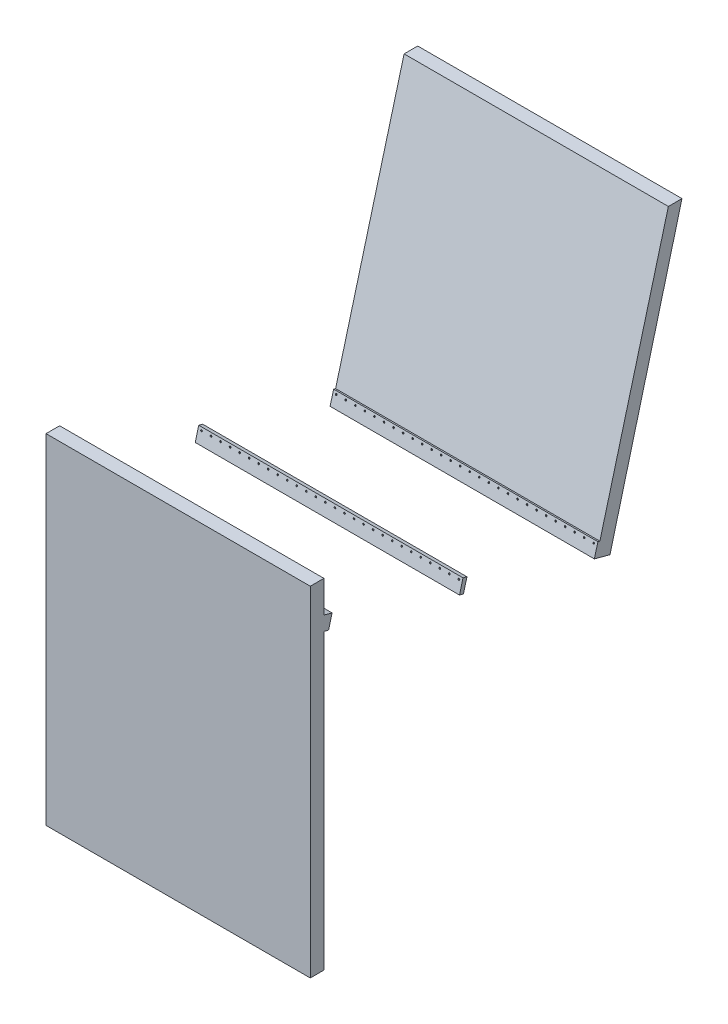
from build123d import *

# Parameters (mm, degrees)
SKETCH1_W                = 1940
SKETCH1_H                = 100
BOSS_EXTRUDE1_DEPTH      = 2000
BOSS_EXTRUDE1_2_DEPTH    = 2000
CUT_EXTRUDE1_DEPTH       = 2481.100804403
CUT_EXTRUDE1_DEPTH_BACK  = 2481.100804403
BOSS_EXTRUDE3_DEPTH      = 970
BOSS_EXTRUDE3_DEPTH_BACK = 970
SKETCH1_3_W              = 1940
SKETCH1_3_H              = 100
BOSS_EXTRUDE4_DEPTH      = 2100
CUT_EXTRUDE2_REACH       = 3721.358
SKETCH1_5_W              = 1940
SKETCH1_5_H              = 100
CUT_EXTRUDE3_REACH       = 2473.755
SKETCH7_W                = 1940
SKETCH7_H                = 995
CUT_EXTRUDE4_DEPTH       = 15
CUT_EXTRUDE5_DEPTH       = 30
CUT_EXTRUDE6_DEPTH       = 15
SKETCH1_6_W              = 1940
SKETCH1_6_H              = 100
BOSS_EXTRUDE5_DEPTH      = 390.899793


with BuildPart() as part:
    # Sketch1 → Boss-Extrude1 (new body)
    with BuildSketch(Plane(origin=(0, 0, 0), x_dir=(1, 0, 0), z_dir=(0, 1, 0))):
        with Locations((0, -1050)):
            Rectangle(SKETCH1_W, SKETCH1_H)
    extrude(amount=BOSS_EXTRUDE1_DEPTH)


with BuildPart() as body_2:
    # Sketch1 → Boss-Extrude1 2 (new body)
    with BuildSketch(Plane(origin=(0, 0, 0), x_dir=(1, 0, 0), z_dir=(0, 1, 0))):
        with Locations((0, 1050)):
            Rectangle(SKETCH1_W, SKETCH1_H)
    extrude(amount=BOSS_EXTRUDE1_2_DEPTH)


with BuildPart() as cut_extrude1_tool:
    # Sketch2 → Cut-Extrude1 (new, two sides: drawn at the far end of the back side and taken through both)
    with BuildSketch(Plane(origin=(0, 0, 0), x_dir=(0, 0, -1), z_dir=(1, 0, 0)).offset(-CUT_EXTRUDE1_DEPTH_BACK)):
        Polygon((1100, 1200), (-1100, 1789.488223348), (-1100, 2789.488223348), (1100, 2789.488223348), align=None)
    extrude(amount=CUT_EXTRUDE1_DEPTH + CUT_EXTRUDE1_DEPTH_BACK)


with BuildPart() as part_1:
    add(part.part)

    # Cut-Extrude1: cut by cut_extrude1_tool
    add(cut_extrude1_tool.part, mode=Mode.SUBTRACT)



with BuildPart() as body_2_1:
    add(body_2.part)

    # Cut-Extrude1: cut by cut_extrude1_tool
    add(cut_extrude1_tool.part, mode=Mode.SUBTRACT)

    # Sketch6 → section 1 of loft2
    with BuildSketch(Plane(origin=(0, 3200, 0), x_dir=(1, 0, 0), z_dir=(0, 1, 0)), mode=Mode.PRIVATE) as loft2_s1:
        with BuildLine():
            Line((-970, 1528.71870789), (970, 1528.71870789))
            Line((970, 1528.71870789), (970, 1628.71870789))
            Line((970, 1628.71870789), (-970, 1628.71870789))
            Line((-970, 1628.71870789), (-970, 1528.71870789))
        make_face()
    # loft from a face of the part (loft2)
    loft([body_2_1.faces().sort_by_distance((0, 1213.397459622, -1050))[0], loft2_s1.sketch])


with BuildPart() as part_2:
    add(part_1.part)

    add(body_2_1.part)  # Boss-Extrude3 merges body 2
    # Sketch4 → Boss-Extrude3 (add, two sides: drawn at the far end of the back side and taken through both)
    with BuildSketch(Plane(origin=(0, 0, 0), x_dir=(0, 0, -1), z_dir=(1, 0, 0)).offset(-BOSS_EXTRUDE3_DEPTH_BACK)):
        Polygon((1100, 1200), (-1100, 1789.488223348), (-1100, 1893.015841389), (1125.558090094, 1296.67934844), align=None)
    extrude(amount=BOSS_EXTRUDE3_DEPTH + BOSS_EXTRUDE3_DEPTH_BACK)

    # Sketch1<3> → Boss-Extrude4 (add)
    with BuildSketch(Plane(origin=(0, 0, 0), x_dir=(1, 0, 0), z_dir=(0, 1, 0))):
        with Locations((0, -1050)):
            Rectangle(SKETCH1_3_W, SKETCH1_3_H)
    extrude(amount=BOSS_EXTRUDE4_DEPTH)

    # Cut-Extrude2: up to this face of the body (flat: up to its plane)
    cut_extrude2_end = Plane(part_2.part.faces().sort_by_distance((0, 1494.744111674, 0))[0])
    # Sketch1<5> → Cut-Extrude2 (cut, up to the picked face)
    with BuildSketch(Plane(origin=(0, 0, 0), x_dir=(1, 0, 0), z_dir=(0, 1, 0)), mode=Mode.PRIVATE) as cut_extrude2_sk1:
        with Locations((0, 1050)):
            Rectangle(SKETCH1_5_W, SKETCH1_5_H)
    cut_extrude2_tool1 = split(extrude(cut_extrude2_sk1.sketch, amount=CUT_EXTRUDE2_REACH, mode=Mode.PRIVATE), bisect_by=cut_extrude2_end, keep=Keep.BOTH, mode=Mode.PRIVATE)
    add(cut_extrude2_tool1.solids().sort_by(Axis((0, 0, -1050), (0, 1, 0)))[0], mode=Mode.SUBTRACT)

    # Sketch7 → Cut-Extrude3 (cut, up to next)
    with BuildSketch(Plane(origin=(0, 1491.2078249, -399.567932429), x_dir=(1, 0, 0), z_dir=(0, 0.9659258262890682, -0.25881904510252124)), mode=Mode.PRIVATE) as cut_extrude3_sk1:
        with Locations((0, 135.907936754)):
            Rectangle(SKETCH7_W, SKETCH7_H)
    cut_extrude3_tool1 = extrude(cut_extrude3_sk1.sketch, amount=-CUT_EXTRUDE3_REACH, mode=Mode.PRIVATE) & part_2.part
    # Sketch7 → Cut-Extrude3 (cut, up to next)
    with BuildSketch(Plane(origin=(0, 1491.2078249, -399.567932429), x_dir=(1, 0, 0), z_dir=(0, 0.9659258262890682, -0.25881904510252124)), mode=Mode.PRIVATE) as cut_extrude3_sk2:
        with Locations((0, -889.092063246)):
            Rectangle(SKETCH7_W, SKETCH7_H)
    cut_extrude3_tool2 = extrude(cut_extrude3_sk2.sketch, amount=-CUT_EXTRUDE3_REACH, mode=Mode.PRIVATE) & part_2.part
    add(cut_extrude3_tool1.solids().sort_by_distance((0, 1456.032262, -530.844919))[0], mode=Mode.SUBTRACT)
    add(cut_extrude3_tool2.solids().sort_by_distance((0, 1721.321784, 459.229053))[0], mode=Mode.SUBTRACT)


with BuildPart() as cut_extrude3_piece_1:
    # of the separate pieces the step leaves, piece 1, a body of its own (cut_extrude3_pieces)
    add(part_2.part.solids().sort_by_distance((-970, 1762.693304105, 1000))[0])

    # Sketch10 → Cut-Extrude6 (cut)
    with BuildSketch(Plane(origin=(0, 358.876433756, 1339.345084417), x_dir=(-1, 0, 0), z_dir=(0, -0.25881904510252124, -0.9659258262890682))):
        Polygon((108.207902433, 1518.25569116), (111.415804866, 1523.81194116), (108.207902433, 1529.36819116), (101.792097567, 1529.36819116), (98.584195134, 1523.81194116), (101.792097567, 1518.25569116), align=None)
        Polygon((-28.584195134, 1523.81194116), (-31.792097567, 1529.36819116), (-38.207902433, 1529.36819116), (-41.415804866, 1523.81194116), (-38.207902433, 1518.25569116), (-31.792097567, 1518.25569116), align=None)
        Polygon((41.415804866, 1523.81194116), (38.207902433, 1529.36819116), (31.792097567, 1529.36819116), (28.584195134, 1523.81194116), (31.792097567, 1518.25569116), (38.207902433, 1518.25569116), align=None)
        Polygon((178.207902433, 1518.25569116), (181.415804866, 1523.81194116), (178.207902433, 1529.36819116), (171.792097567, 1529.36819116), (168.584195134, 1523.81194116), (171.792097567, 1518.25569116), align=None)
        Polygon((248.207902433, 1518.25569116), (251.415804866, 1523.81194116), (248.207902433, 1529.36819116), (241.792097567, 1529.36819116), (238.584195134, 1523.81194116), (241.792097567, 1518.25569116), align=None)
        Polygon((318.207902433, 1518.25569116), (321.415804866, 1523.81194116), (318.207902433, 1529.36819116), (311.792097567, 1529.36819116), (308.584195134, 1523.81194116), (311.792097567, 1518.25569116), align=None)
        Polygon((388.207902433, 1518.25569116), (391.415804866, 1523.81194116), (388.207902433, 1529.36819116), (381.792097567, 1529.36819116), (378.584195134, 1523.81194116), (381.792097567, 1518.25569116), align=None)
        Polygon((458.207902433, 1518.25569116), (461.415804866, 1523.81194116), (458.207902433, 1529.36819116), (451.792097567, 1529.36819116), (448.584195134, 1523.81194116), (451.792097567, 1518.25569116), align=None)
        Polygon((528.207902433, 1518.25569116), (531.415804866, 1523.81194116), (528.207902433, 1529.36819116), (521.792097567, 1529.36819116), (518.584195134, 1523.81194116), (521.792097567, 1518.25569116), align=None)
        Polygon((598.207902433, 1518.25569116), (601.415804866, 1523.81194116), (598.207902433, 1529.36819116), (591.792097567, 1529.36819116), (588.584195134, 1523.81194116), (591.792097567, 1518.25569116), align=None)
        Polygon((668.207902433, 1518.25569116), (671.415804866, 1523.81194116), (668.207902433, 1529.36819116), (661.792097567, 1529.36819116), (658.584195134, 1523.81194116), (661.792097567, 1518.25569116), align=None)
        Polygon((738.207902433, 1518.25569116), (741.415804866, 1523.81194116), (738.207902433, 1529.36819116), (731.792097567, 1529.36819116), (728.584195134, 1523.81194116), (731.792097567, 1518.25569116), align=None)
        Polygon((808.207902433, 1518.25569116), (811.415804866, 1523.81194116), (808.207902433, 1529.36819116), (801.792097567, 1529.36819116), (798.584195134, 1523.81194116), (801.792097567, 1518.25569116), align=None)
        Polygon((878.207902433, 1518.25569116), (881.415804866, 1523.81194116), (878.207902433, 1529.36819116), (871.792097567, 1529.36819116), (868.584195134, 1523.81194116), (871.792097567, 1518.25569116), align=None)
        Polygon((948.207902433, 1518.25569116), (951.415804866, 1523.81194116), (948.207902433, 1529.36819116), (941.792097567, 1529.36819116), (938.584195134, 1523.81194116), (941.792097567, 1518.25569116), align=None)
        Polygon((-101.792097567, 1529.36819116), (-108.207902433, 1529.36819116), (-111.415804866, 1523.81194116), (-108.207902433, 1518.25569116), (-101.792097567, 1518.25569116), (-98.584195134, 1523.81194116), align=None)
        Polygon((-171.792097567, 1529.36819116), (-178.207902433, 1529.36819116), (-181.415804866, 1523.81194116), (-178.207902433, 1518.25569116), (-171.792097567, 1518.25569116), (-168.584195134, 1523.81194116), align=None)
        Polygon((-241.792097567, 1529.36819116), (-248.207902433, 1529.36819116), (-251.415804866, 1523.81194116), (-248.207902433, 1518.25569116), (-241.792097567, 1518.25569116), (-238.584195134, 1523.81194116), align=None)
        Polygon((-311.792097567, 1529.36819116), (-318.207902433, 1529.36819116), (-321.415804866, 1523.81194116), (-318.207902433, 1518.25569116), (-311.792097567, 1518.25569116), (-308.584195134, 1523.81194116), align=None)
        Polygon((-381.792097567, 1529.36819116), (-388.207902433, 1529.36819116), (-391.415804866, 1523.81194116), (-388.207902433, 1518.25569116), (-381.792097567, 1518.25569116), (-378.584195134, 1523.81194116), align=None)
        Polygon((-451.792097567, 1529.36819116), (-458.207902433, 1529.36819116), (-461.415804866, 1523.81194116), (-458.207902433, 1518.25569116), (-451.792097567, 1518.25569116), (-448.584195134, 1523.81194116), align=None)
        Polygon((-521.792097567, 1529.36819116), (-528.207902433, 1529.36819116), (-531.415804866, 1523.81194116), (-528.207902433, 1518.25569116), (-521.792097567, 1518.25569116), (-518.584195134, 1523.81194116), align=None)
        Polygon((-591.792097567, 1529.36819116), (-598.207902433, 1529.36819116), (-601.415804866, 1523.81194116), (-598.207902433, 1518.25569116), (-591.792097567, 1518.25569116), (-588.584195134, 1523.81194116), align=None)
        Polygon((-661.792097567, 1529.36819116), (-668.207902433, 1529.36819116), (-671.415804866, 1523.81194116), (-668.207902433, 1518.25569116), (-661.792097567, 1518.25569116), (-658.584195134, 1523.81194116), align=None)
        Polygon((-731.792097567, 1529.36819116), (-738.207902433, 1529.36819116), (-741.415804866, 1523.81194116), (-738.207902433, 1518.25569116), (-731.792097567, 1518.25569116), (-728.584195134, 1523.81194116), align=None)
        Polygon((-801.792097567, 1529.36819116), (-808.207902433, 1529.36819116), (-811.415804866, 1523.81194116), (-808.207902433, 1518.25569116), (-801.792097567, 1518.25569116), (-798.584195134, 1523.81194116), align=None)
        Polygon((-871.792097567, 1529.36819116), (-878.207902433, 1529.36819116), (-881.415804866, 1523.81194116), (-878.207902433, 1518.25569116), (-871.792097567, 1518.25569116), (-868.584195134, 1523.81194116), align=None)
        Polygon((-941.792097567, 1529.36819116), (-948.207902433, 1529.36819116), (-951.415804866, 1523.81194116), (-948.207902433, 1518.25569116), (-941.792097567, 1518.25569116), (-938.584195134, 1523.81194116), align=None)
    extrude(amount=-CUT_EXTRUDE6_DEPTH, mode=Mode.SUBTRACT)

    # Sketch1<6> → Boss-Extrude5 (add)
    with BuildSketch(Plane(origin=(0, 0, 0), x_dir=(1, 0, 0), z_dir=(0, 1, 0))):
        with Locations((0, -1050)):
            Rectangle(SKETCH1_6_W, SKETCH1_6_H)
    extrude(amount=-BOSS_EXTRUDE5_DEPTH)


with BuildPart() as cut_extrude3_piece_2:
    # of the separate pieces the step leaves, piece 2, a body of its own (cut_extrude3_pieces)
    add(part_2.part.solids().sort_by_distance((970, 1230.67720492, -985.511112606))[0])

    # Sketch8 → Cut-Extrude4 (cut)
    with BuildSketch(Plane(origin=(0, -163.938037351, -611.825084687), x_dir=(1, 0, 0), z_dir=(0, 0.25881904510252124, 0.9659258262890682))):
        Polygon((-108.207902433, 1518.25569116), (-101.792097567, 1518.25569116), (-98.584195134, 1523.81194116), (-101.792097567, 1529.36819116), (-108.207902433, 1529.36819116), (-111.415804866, 1523.81194116), align=None)
        Polygon((-28.584195134, 1523.81194116), (-31.792097567, 1529.36819116), (-38.207902433, 1529.36819116), (-41.415804866, 1523.81194116), (-38.207902433, 1518.25569116), (-31.792097567, 1518.25569116), align=None)
        Polygon((-178.207902433, 1518.25569116), (-171.792097567, 1518.25569116), (-168.584195134, 1523.81194116), (-171.792097567, 1529.36819116), (-178.207902433, 1529.36819116), (-181.415804866, 1523.81194116), align=None)
        Polygon((-248.207902433, 1518.25569116), (-241.792097567, 1518.25569116), (-238.584195134, 1523.81194116), (-241.792097567, 1529.36819116), (-248.207902433, 1529.36819116), (-251.415804866, 1523.81194116), align=None)
        Polygon((-318.207902433, 1518.25569116), (-311.792097567, 1518.25569116), (-308.584195134, 1523.81194116), (-311.792097567, 1529.36819116), (-318.207902433, 1529.36819116), (-321.415804866, 1523.81194116), align=None)
        Polygon((-388.207902433, 1518.25569116), (-381.792097567, 1518.25569116), (-378.584195134, 1523.81194116), (-381.792097567, 1529.36819116), (-388.207902433, 1529.36819116), (-391.415804866, 1523.81194116), align=None)
        Polygon((-458.207902433, 1518.25569116), (-451.792097567, 1518.25569116), (-448.584195134, 1523.81194116), (-451.792097567, 1529.36819116), (-458.207902433, 1529.36819116), (-461.415804866, 1523.81194116), align=None)
        Polygon((-528.207902433, 1518.25569116), (-521.792097567, 1518.25569116), (-518.584195134, 1523.81194116), (-521.792097567, 1529.36819116), (-528.207902433, 1529.36819116), (-531.415804866, 1523.81194116), align=None)
        Polygon((-598.207902433, 1518.25569116), (-591.792097567, 1518.25569116), (-588.584195134, 1523.81194116), (-591.792097567, 1529.36819116), (-598.207902433, 1529.36819116), (-601.415804866, 1523.81194116), align=None)
        Polygon((-668.207902433, 1518.25569116), (-661.792097567, 1518.25569116), (-658.584195134, 1523.81194116), (-661.792097567, 1529.36819116), (-668.207902433, 1529.36819116), (-671.415804866, 1523.81194116), align=None)
        Polygon((-738.207902433, 1518.25569116), (-731.792097567, 1518.25569116), (-728.584195134, 1523.81194116), (-731.792097567, 1529.36819116), (-738.207902433, 1529.36819116), (-741.415804866, 1523.81194116), align=None)
        Polygon((-808.207902433, 1518.25569116), (-801.792097567, 1518.25569116), (-798.584195134, 1523.81194116), (-801.792097567, 1529.36819116), (-808.207902433, 1529.36819116), (-811.415804866, 1523.81194116), align=None)
        Polygon((-878.207902433, 1518.25569116), (-871.792097567, 1518.25569116), (-868.584195134, 1523.81194116), (-871.792097567, 1529.36819116), (-878.207902433, 1529.36819116), (-881.415804866, 1523.81194116), align=None)
        Polygon((-948.207902433, 1518.25569116), (-941.792097567, 1518.25569116), (-938.584195134, 1523.81194116), (-941.792097567, 1529.36819116), (-948.207902433, 1529.36819116), (-951.415804866, 1523.81194116), align=None)
        Polygon((101.792097567, 1518.25569116), (108.207902433, 1518.25569116), (111.415804866, 1523.81194116), (108.207902433, 1529.36819116), (101.792097567, 1529.36819116), (98.584195134, 1523.81194116), align=None)
        Polygon((41.415804866, 1523.81194116), (38.207902433, 1529.36819116), (31.792097567, 1529.36819116), (28.584195134, 1523.81194116), (31.792097567, 1518.25569116), (38.207902433, 1518.25569116), align=None)
        Polygon((171.792097567, 1518.25569116), (178.207902433, 1518.25569116), (181.415804866, 1523.81194116), (178.207902433, 1529.36819116), (171.792097567, 1529.36819116), (168.584195134, 1523.81194116), align=None)
        Polygon((241.792097567, 1518.25569116), (248.207902433, 1518.25569116), (251.415804866, 1523.81194116), (248.207902433, 1529.36819116), (241.792097567, 1529.36819116), (238.584195134, 1523.81194116), align=None)
        Polygon((311.792097567, 1518.25569116), (318.207902433, 1518.25569116), (321.415804866, 1523.81194116), (318.207902433, 1529.36819116), (311.792097567, 1529.36819116), (308.584195134, 1523.81194116), align=None)
        Polygon((381.792097567, 1518.25569116), (388.207902433, 1518.25569116), (391.415804866, 1523.81194116), (388.207902433, 1529.36819116), (381.792097567, 1529.36819116), (378.584195134, 1523.81194116), align=None)
        Polygon((451.792097567, 1518.25569116), (458.207902433, 1518.25569116), (461.415804866, 1523.81194116), (458.207902433, 1529.36819116), (451.792097567, 1529.36819116), (448.584195134, 1523.81194116), align=None)
        Polygon((521.792097567, 1518.25569116), (528.207902433, 1518.25569116), (531.415804866, 1523.81194116), (528.207902433, 1529.36819116), (521.792097567, 1529.36819116), (518.584195134, 1523.81194116), align=None)
        Polygon((591.792097567, 1518.25569116), (598.207902433, 1518.25569116), (601.415804866, 1523.81194116), (598.207902433, 1529.36819116), (591.792097567, 1529.36819116), (588.584195134, 1523.81194116), align=None)
        Polygon((661.792097567, 1518.25569116), (668.207902433, 1518.25569116), (671.415804866, 1523.81194116), (668.207902433, 1529.36819116), (661.792097567, 1529.36819116), (658.584195134, 1523.81194116), align=None)
        Polygon((731.792097567, 1518.25569116), (738.207902433, 1518.25569116), (741.415804866, 1523.81194116), (738.207902433, 1529.36819116), (731.792097567, 1529.36819116), (728.584195134, 1523.81194116), align=None)
        Polygon((801.792097567, 1518.25569116), (808.207902433, 1518.25569116), (811.415804866, 1523.81194116), (808.207902433, 1529.36819116), (801.792097567, 1529.36819116), (798.584195134, 1523.81194116), align=None)
        Polygon((871.792097567, 1518.25569116), (878.207902433, 1518.25569116), (881.415804866, 1523.81194116), (878.207902433, 1529.36819116), (871.792097567, 1529.36819116), (868.584195134, 1523.81194116), align=None)
        Polygon((941.792097567, 1518.25569116), (948.207902433, 1518.25569116), (951.415804866, 1523.81194116), (948.207902433, 1529.36819116), (941.792097567, 1529.36819116), (938.584195134, 1523.81194116), align=None)
    extrude(amount=-CUT_EXTRUDE4_DEPTH, mode=Mode.SUBTRACT)


with BuildPart() as cut_extrude3_piece_3:
    # of the separate pieces the step leaves, piece 3, a body of its own (cut_extrude3_pieces)
    add(part_2.part.solids().sort_by_distance((970, 1495.96672615, 4.562859341))[0])

    # Sketch9 → Cut-Extrude5 (cut)
    with BuildSketch(Plane(origin=(0, 93.586912526, 349.271112471), x_dir=(-1, 0, 0), z_dir=(0, -0.25881904510252124, -0.9659258262890682))):
        Polygon((108.207902433, 1529.36819116), (101.792097567, 1529.36819116), (98.584195134, 1523.81194116), (101.792097567, 1518.25569116), (108.207902433, 1518.25569116), (111.415804866, 1523.81194116), align=None)
        Polygon((-28.584195134, 1523.81194116), (-31.792097567, 1529.36819116), (-38.207902433, 1529.36819116), (-41.415804866, 1523.81194116), (-38.207902433, 1518.25569116), (-31.792097567, 1518.25569116), align=None)
        Polygon((41.415804866, 1523.81194116), (38.207902433, 1529.36819116), (31.792097567, 1529.36819116), (28.584195134, 1523.81194116), (31.792097567, 1518.25569116), (38.207902433, 1518.25569116), align=None)
        Polygon((178.207902433, 1529.36819116), (171.792097567, 1529.36819116), (168.584195134, 1523.81194116), (171.792097567, 1518.25569116), (178.207902433, 1518.25569116), (181.415804866, 1523.81194116), align=None)
        Polygon((248.207902433, 1529.36819116), (241.792097567, 1529.36819116), (238.584195134, 1523.81194116), (241.792097567, 1518.25569116), (248.207902433, 1518.25569116), (251.415804866, 1523.81194116), align=None)
        Polygon((318.207902433, 1529.36819116), (311.792097567, 1529.36819116), (308.584195134, 1523.81194116), (311.792097567, 1518.25569116), (318.207902433, 1518.25569116), (321.415804866, 1523.81194116), align=None)
        Polygon((388.207902433, 1529.36819116), (381.792097567, 1529.36819116), (378.584195134, 1523.81194116), (381.792097567, 1518.25569116), (388.207902433, 1518.25569116), (391.415804866, 1523.81194116), align=None)
        Polygon((458.207902433, 1529.36819116), (451.792097567, 1529.36819116), (448.584195134, 1523.81194116), (451.792097567, 1518.25569116), (458.207902433, 1518.25569116), (461.415804866, 1523.81194116), align=None)
        Polygon((528.207902433, 1529.36819116), (521.792097567, 1529.36819116), (518.584195134, 1523.81194116), (521.792097567, 1518.25569116), (528.207902433, 1518.25569116), (531.415804866, 1523.81194116), align=None)
        Polygon((598.207902433, 1529.36819116), (591.792097567, 1529.36819116), (588.584195134, 1523.81194116), (591.792097567, 1518.25569116), (598.207902433, 1518.25569116), (601.415804866, 1523.81194116), align=None)
        Polygon((668.207902433, 1529.36819116), (661.792097567, 1529.36819116), (658.584195134, 1523.81194116), (661.792097567, 1518.25569116), (668.207902433, 1518.25569116), (671.415804866, 1523.81194116), align=None)
        Polygon((738.207902433, 1529.36819116), (731.792097567, 1529.36819116), (728.584195134, 1523.81194116), (731.792097567, 1518.25569116), (738.207902433, 1518.25569116), (741.415804866, 1523.81194116), align=None)
        Polygon((808.207902433, 1529.36819116), (801.792097567, 1529.36819116), (798.584195134, 1523.81194116), (801.792097567, 1518.25569116), (808.207902433, 1518.25569116), (811.415804866, 1523.81194116), align=None)
        Polygon((878.207902433, 1529.36819116), (871.792097567, 1529.36819116), (868.584195134, 1523.81194116), (871.792097567, 1518.25569116), (878.207902433, 1518.25569116), (881.415804866, 1523.81194116), align=None)
        Polygon((948.207902433, 1529.36819116), (941.792097567, 1529.36819116), (938.584195134, 1523.81194116), (941.792097567, 1518.25569116), (948.207902433, 1518.25569116), (951.415804866, 1523.81194116), align=None)
        Polygon((-101.792097567, 1529.36819116), (-108.207902433, 1529.36819116), (-111.415804866, 1523.81194116), (-108.207902433, 1518.25569116), (-101.792097567, 1518.25569116), (-98.584195134, 1523.81194116), align=None)
        Polygon((-171.792097567, 1529.36819116), (-178.207902433, 1529.36819116), (-181.415804866, 1523.81194116), (-178.207902433, 1518.25569116), (-171.792097567, 1518.25569116), (-168.584195134, 1523.81194116), align=None)
        Polygon((-241.792097567, 1529.36819116), (-248.207902433, 1529.36819116), (-251.415804866, 1523.81194116), (-248.207902433, 1518.25569116), (-241.792097567, 1518.25569116), (-238.584195134, 1523.81194116), align=None)
        Polygon((-311.792097567, 1529.36819116), (-318.207902433, 1529.36819116), (-321.415804866, 1523.81194116), (-318.207902433, 1518.25569116), (-311.792097567, 1518.25569116), (-308.584195134, 1523.81194116), align=None)
        Polygon((-381.792097567, 1529.36819116), (-388.207902433, 1529.36819116), (-391.415804866, 1523.81194116), (-388.207902433, 1518.25569116), (-381.792097567, 1518.25569116), (-378.584195134, 1523.81194116), align=None)
        Polygon((-451.792097567, 1529.36819116), (-458.207902433, 1529.36819116), (-461.415804866, 1523.81194116), (-458.207902433, 1518.25569116), (-451.792097567, 1518.25569116), (-448.584195134, 1523.81194116), align=None)
        Polygon((-521.792097567, 1529.36819116), (-528.207902433, 1529.36819116), (-531.415804866, 1523.81194116), (-528.207902433, 1518.25569116), (-521.792097567, 1518.25569116), (-518.584195134, 1523.81194116), align=None)
        Polygon((-591.792097567, 1529.36819116), (-598.207902433, 1529.36819116), (-601.415804866, 1523.81194116), (-598.207902433, 1518.25569116), (-591.792097567, 1518.25569116), (-588.584195134, 1523.81194116), align=None)
        Polygon((-661.792097567, 1529.36819116), (-668.207902433, 1529.36819116), (-671.415804866, 1523.81194116), (-668.207902433, 1518.25569116), (-661.792097567, 1518.25569116), (-658.584195134, 1523.81194116), align=None)
        Polygon((-731.792097567, 1529.36819116), (-738.207902433, 1529.36819116), (-741.415804866, 1523.81194116), (-738.207902433, 1518.25569116), (-731.792097567, 1518.25569116), (-728.584195134, 1523.81194116), align=None)
        Polygon((-801.792097567, 1529.36819116), (-808.207902433, 1529.36819116), (-811.415804866, 1523.81194116), (-808.207902433, 1518.25569116), (-801.792097567, 1518.25569116), (-798.584195134, 1523.81194116), align=None)
        Polygon((-871.792097567, 1529.36819116), (-878.207902433, 1529.36819116), (-881.415804866, 1523.81194116), (-878.207902433, 1518.25569116), (-871.792097567, 1518.25569116), (-868.584195134, 1523.81194116), align=None)
        Polygon((-941.792097567, 1529.36819116), (-948.207902433, 1529.36819116), (-951.415804866, 1523.81194116), (-948.207902433, 1518.25569116), (-941.792097567, 1518.25569116), (-938.584195134, 1523.81194116), align=None)
    extrude(amount=-CUT_EXTRUDE5_DEPTH, mode=Mode.SUBTRACT)


solid = Compound([cut_extrude3_piece_1.part, cut_extrude3_piece_2.part, cut_extrude3_piece_3.part])
